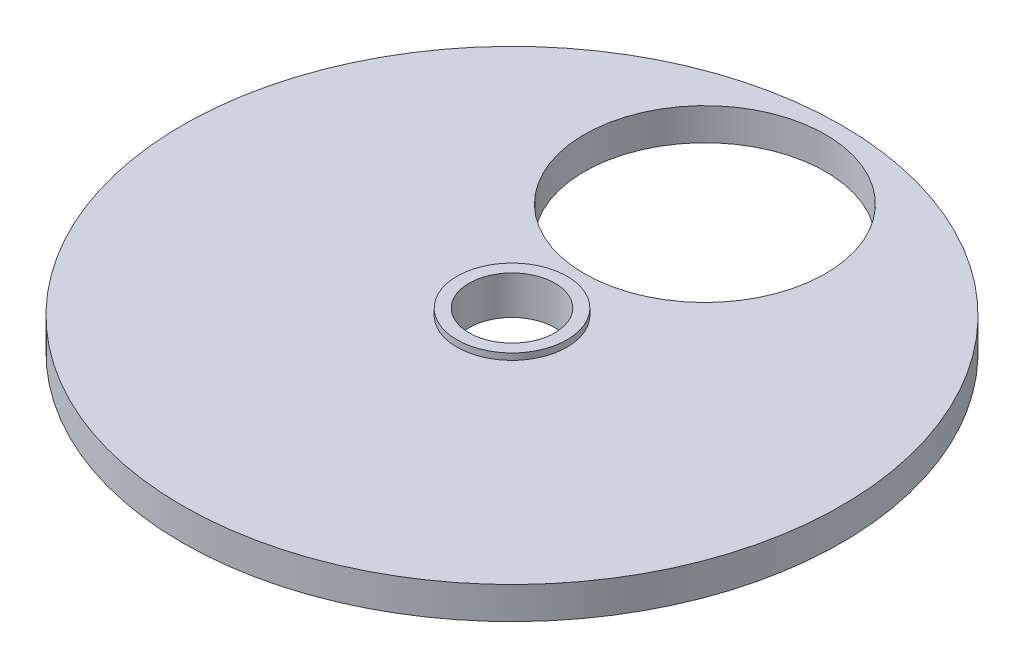
from build123d import *

# Parameters (mm, degrees)
SKETCH1_R           = 20.5
BOSS_EXTRUDE1_DEPTH = 2
SKETCH2_R           = 2.675
CUT_EXTRUDE1_DEPTH  = 2
BOSS_EXTRUDE2_START = 0.4
SKETCH3_R           = 3.425
SKETCH3_R_2         = 2.675
BOSS_EXTRUDE2_DEPTH = 0.4
SKETCH5_R           = 7.5
CUT_EXTRUDE3_DEPTH  = 2


with BuildPart() as part:
    # Sketch1 → Boss-Extrude1 (new body)
    with BuildSketch(Plane(origin=(0, 0, 0), x_dir=(1, 0, 0), z_dir=(0, 1, 0))):
        with Locations(Location((0, 0, 0), (0, 0, 270))):
            Circle(SKETCH1_R)
    extrude(amount=BOSS_EXTRUDE1_DEPTH)

    # Sketch2 → Cut-Extrude1 (cut)
    with BuildSketch(Plane(origin=(0, 2, 0), x_dir=(1, 0, 0), z_dir=(0, 1, 0))):
        with Locations(Location((0, 0, 0), (0, 0, 270))):
            Circle(SKETCH2_R)
    extrude(amount=-CUT_EXTRUDE1_DEPTH, mode=Mode.SUBTRACT)

    # Sketch3 → Boss-Extrude2 (add)
    with BuildSketch(Plane(origin=(0, 2, 0), x_dir=(1, 0, 0), z_dir=(0, 1, 0)).offset(BOSS_EXTRUDE2_START)):
        with Locations(Location((0, 0, 0), (0, 0, 270))):
            Circle(SKETCH3_R)
        with Locations(Location((0, 0, 0), (0, 0, 270))):
            Circle(SKETCH3_R_2, mode=Mode.SUBTRACT)
    extrude(amount=-BOSS_EXTRUDE2_DEPTH)

    # Sketch5 → Cut-Extrude3 (cut)
    with BuildSketch(Plane(origin=(0, 2, 0), x_dir=(1, 0, 0), z_dir=(0, 1, 0))):
        with Locations(Location((0, 12, 0), (0, 0, 270))):
            Circle(SKETCH5_R)
    extrude(amount=-CUT_EXTRUDE3_DEPTH, mode=Mode.SUBTRACT)


solid = part.part
